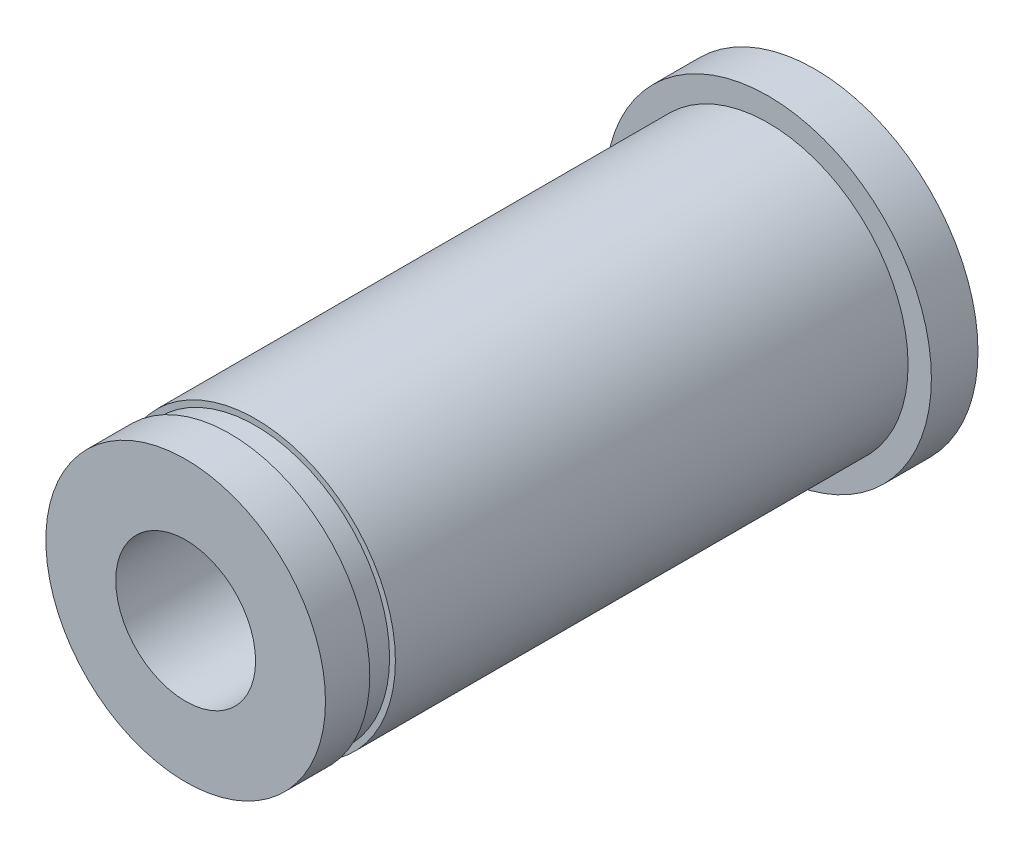
from build123d import *

# Parameters (mm, degrees)
SKETCH_1_R          = 6
EXTRUDE_1_DEPTH     = 25
SKETCH_2_R          = 7
EXTRUDE_2_DEPTH     = 2
SKETCH_3_W          = 0.25
SKETCH_3_H          = 1.1
SKETCH_4_R          = 3
CUT_EXTRUDE_1_DEPTH = 28


with BuildPart() as part:
    # 草图1 → 凸台-拉伸1 (new body)
    with BuildSketch(Plane.XY):
        Circle(SKETCH_1_R)
    extrude(amount=EXTRUDE_1_DEPTH)

    # 草图2 → 凸台-拉伸2 (add)
    with BuildSketch(Plane(origin=(0, 0, 0), x_dir=(-1, 0, 0), z_dir=(0, 0, -1))):
        Circle(SKETCH_2_R)
    extrude(amount=EXTRUDE_2_DEPTH)

    # 草图3 → 切除-旋转1 (revolve, cut)
    with BuildSketch(Plane(origin=(0, 0, 0), x_dir=(1, 0, 0), z_dir=(0, 1, 0)), mode=Mode.PRIVATE) as cut_revolve_1_sk:
        with Locations((-5.875, -22.55)):
            Rectangle(SKETCH_3_W, SKETCH_3_H)
    revolve(cut_revolve_1_sk.sketch.rotate(Axis((0, 0, 25), (0, 0, -1)), 180), axis=Axis((0, 0, 25), (0, 0, -1)), mode=Mode.SUBTRACT)

    # 草图4 → 切除-拉伸1 (cut)
    with BuildSketch(Plane(origin=(0, 0, -2), x_dir=(-1, 0, 0), z_dir=(0, 0, -1))):
        Circle(SKETCH_4_R)
    extrude(amount=-CUT_EXTRUDE_1_DEPTH, mode=Mode.SUBTRACT)


solid = part.part
